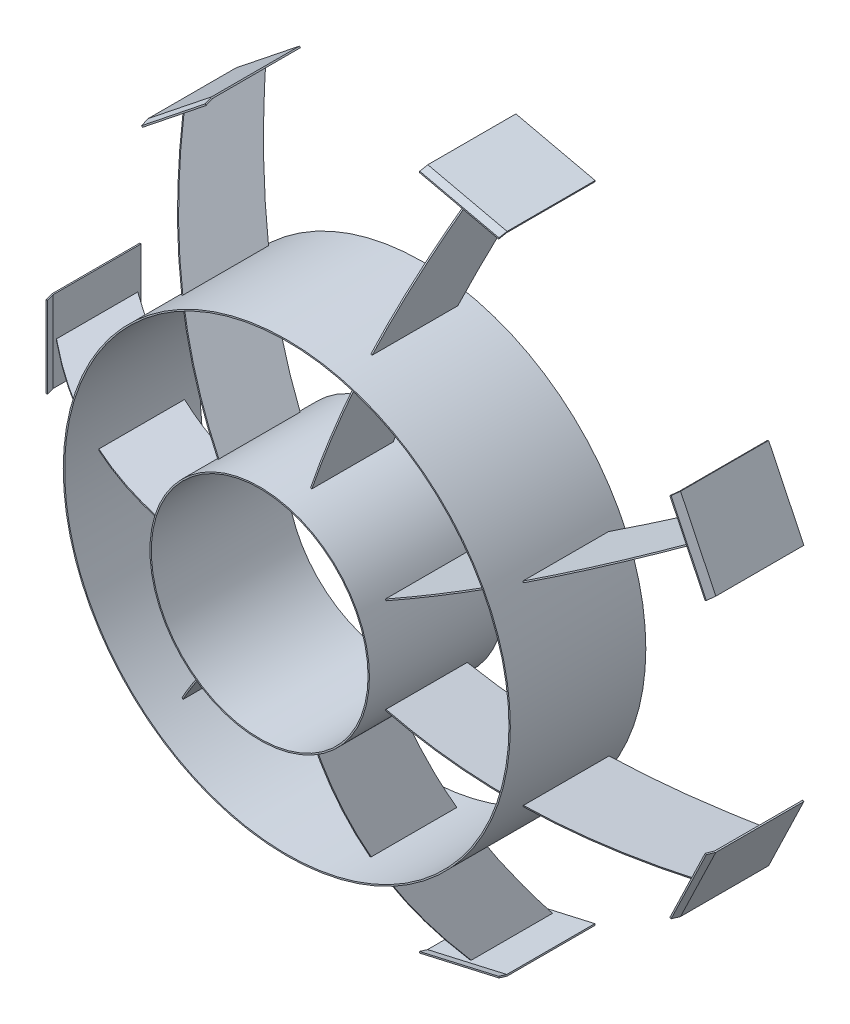
from build123d import *

# Parameters (mm, degrees)
SKETCH_1_R               = 16.5
SKETCH_1_R_2             = 16.4
EXTRUDE_1_DEPTH          = 10
SKETCH_2_R               = 8.1
SKETCH_2_R_2             = 8
EXTRUDE_2_DEPTH          = 10
EXTRUDE_3_DEPTH          = 0.05
SKETCH_4_R               = 8
CUT_EXTRUDE_1_DEPTH      = 500
PATTERN_CIRCULAR_1_COUNT = 7
PATTERN_CIRCULAR_2_COUNT = 7
SKETCH_7_W               = 6.5
SKETCH_7_H               = 6
EXTRUDE_6_DEPTH          = 0.1
EXTRUDE_7_DEPTH          = 6
PATTERN_CIRCULAR_4_COUNT = 7


with BuildPart() as part:
    # 草图1 → 凸台-拉伸1 (new body)
    with BuildSketch(Plane.XY):
        Circle(SKETCH_1_R)
        Circle(SKETCH_1_R_2, mode=Mode.SUBTRACT)
    extrude(amount=EXTRUDE_1_DEPTH)



with BuildPart() as body_2:
    # 草图2 → 凸台-拉伸2 (new body)
    with BuildSketch(Plane.XY.offset(12)):
        Circle(SKETCH_2_R)
        Circle(SKETCH_2_R_2, mode=Mode.SUBTRACT)
    extrude(amount=-EXTRUDE_2_DEPTH)


with BuildPart() as part_1:
    add(part.part)

    add(body_2.part)  # 凸台-拉伸3 merges body 2
    # 草图3 → 凸台-拉伸3 (add, symmetric)
    with BuildSketch(Plane(origin=(0, 0, 0), x_dir=(1, 0, 0), z_dir=(0, 1, 0))):
        with BuildLine():
            Line((-25, 4), (-25, -2))
            add(Edge.make_bspline(
                [(-8.1, -10), (-14.903316382, -8.862576984), (-20.161776557, -5.929013804), (-25, -2)],
                knots=[0, 0, 0, 0, 1, 1, 1, 1], degree=3))
            Line((-8.1, -10), (-7.236819544, -10))
            Line((-7.236819544, -10), (-7.236819544, -4))
            Line((-7.236819544, -4), (-8.1, -4))
            add(Edge.make_bspline(
                [(-8.1, -4), (-14.387137683, -2.63727797), (-19.938891029, 0.362592745), (-25, 4)],
                knots=[0, 0, 0, 0, 1, 1, 1, 1], degree=3))
        make_face()
    extrude_3 = extrude(amount=EXTRUDE_3_DEPTH, both=True)

    # 草图4 → 切除-拉伸1 (cut)
    with BuildSketch(Plane.XY.offset(12)):
        Circle(SKETCH_4_R)
    cut_extrude_1 = extrude(amount=-CUT_EXTRUDE_1_DEPTH, mode=Mode.SUBTRACT)

    # 阵列(圆周)1: 凸台-拉伸3 ×7 about axis
    pattern_circular_1_axis = Axis((0, 0, 10), (0, 0, -1))
    for i in range(1, PATTERN_CIRCULAR_1_COUNT):
        add(extrude_3.rotate(pattern_circular_1_axis, i * 360 / PATTERN_CIRCULAR_1_COUNT))

    # 阵列(圆周)2: 切除-拉伸1 ×7 about axis
    pattern_circular_2_axis = Axis((0, 0, 10), (0, 0, -1))
    for i in range(1, PATTERN_CIRCULAR_2_COUNT):
        add(cut_extrude_1.rotate(pattern_circular_2_axis, i * 360 / PATTERN_CIRCULAR_2_COUNT), mode=Mode.SUBTRACT)

    # 草图7 → 凸台-拉伸6 (add)
    with BuildSketch(Plane(origin=(22.524221698, -10.847093478, 0), x_dir=(0, 0, -1), z_dir=(0.9009688679024218, -0.43388373911755285, 0))):
        with Locations((1, 0)):
            Rectangle(SKETCH_7_W, SKETCH_7_H)
    extrude_6 = extrude(amount=EXTRUDE_6_DEPTH)

    # 草图8 → 凸台-拉伸7 (add)
    with BuildSketch(Plane(origin=(-1.301651217, -2.702906604, 0), x_dir=(0.9009688679024217, -0.4338837391175529, 0), z_dir=(-0.4338837391175529, -0.9009688679024217, 0))):
        Polygon((25, 2.25), (24.848570959, 2.815140874), (24.948570959, 2.815140874), (25.1, 2.25), align=None)
    extrude_7 = extrude(amount=-EXTRUDE_7_DEPTH)

    # 阵列(圆周)4: 凸台-拉伸6, 凸台-拉伸7 ×7 about axis
    pattern_circular_4_axis = Axis((0, 0, 0), (0, 0, 1))
    add([extrude_6.rotate(pattern_circular_4_axis, i * 360 / PATTERN_CIRCULAR_4_COUNT) for i in range(1, PATTERN_CIRCULAR_4_COUNT)])
    add([extrude_7.rotate(pattern_circular_4_axis, i * 360 / PATTERN_CIRCULAR_4_COUNT) for i in range(1, PATTERN_CIRCULAR_4_COUNT)])


solid = part_1.part
